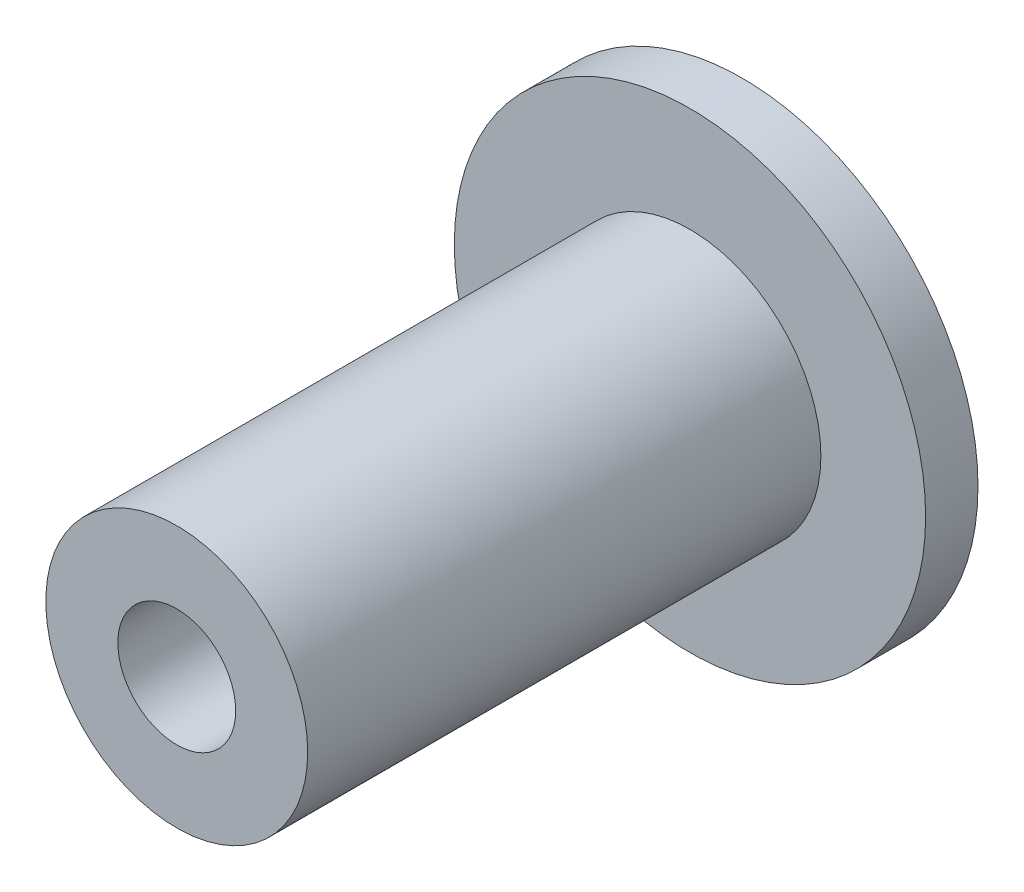
from build123d import *

# Parameters (mm, degrees)
CROQUIS1_R              = 5
CROQUIS1_R_2            = 4.25
SALIENTE_EXTRUIR1_DEPTH = 19.6
CROQUIS2_R              = 9
CROQUIS2_R_2            = 4.25
SALIENTE_EXTRUIR2_DEPTH = 2
CROQUIS3_R              = 5
SALIENTE_EXTRUIR3_DEPTH = 5
CROQUIS4_R              = 2.25
CORTAR_EXTRUIR1_DEPTH   = 6
SALIENTE_EXTRUIR4_START = -16.6
CROQUIS5_R              = 4.25
SALIENTE_EXTRUIR4_DEPTH = 16.6


with BuildPart() as part:
    # Croquis1 → Saliente-Extruir1 (new body)
    with BuildSketch(Plane.XY):
        Circle(CROQUIS1_R)
        Circle(CROQUIS1_R_2, mode=Mode.SUBTRACT)
    extrude(amount=-SALIENTE_EXTRUIR1_DEPTH)

    # Croquis2 → Saliente-Extruir2 (add)
    with BuildSketch(Plane(origin=(0, 0, -19.6), x_dir=(-1, 0, 0), z_dir=(0, 0, -1))):
        Circle(CROQUIS2_R)
        with Locations(Location((0, 0, 0), (0, 0, 180))):
            Circle(CROQUIS2_R_2, mode=Mode.SUBTRACT)
    extrude(amount=SALIENTE_EXTRUIR2_DEPTH)

    # Croquis3 → Saliente-Extruir3 (add)
    with BuildSketch(Plane.XY):
        Circle(CROQUIS3_R)
    extrude(amount=-SALIENTE_EXTRUIR3_DEPTH)

    # Croquis4 → Cortar-Extruir1 (cut)
    with BuildSketch(Plane.XY):
        Circle(CROQUIS4_R)
    extrude(amount=-CORTAR_EXTRUIR1_DEPTH, mode=Mode.SUBTRACT)

    # Croquis5 → Saliente-Extruir4 (add)
    with BuildSketch(Plane(origin=(0, 0, -21.6), x_dir=(-1, 0, 0), z_dir=(0, 0, -1)).offset(SALIENTE_EXTRUIR4_START)):
        Circle(CROQUIS5_R)
    extrude(amount=SALIENTE_EXTRUIR4_DEPTH)


solid = part.part
